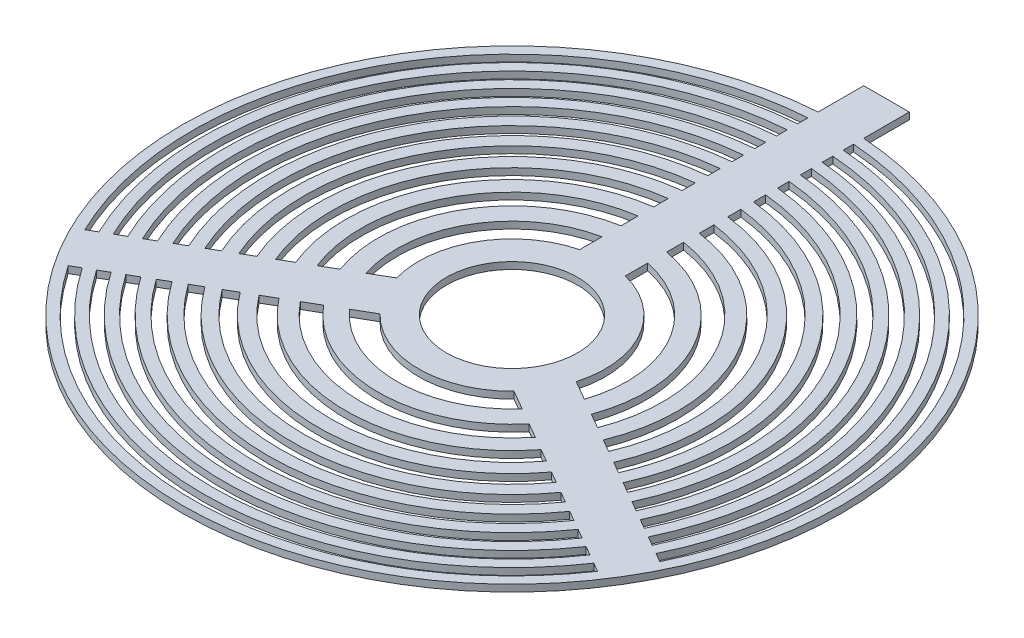
from build123d import *

# Parameters (mm, degrees)
SKETCH_4_R      = 28.77
EXTRUDE_1_DEPTH = 3


with BuildPart() as part:
    # 草图4 → 凸台-拉伸1 (new body)
    with BuildSketch(Plane(origin=(0, 0, 0), x_dir=(1, 0, 0), z_dir=(0, 1, 0))):
        with BuildLine():
            Line((-10, 144.374091859), (-10, 164.374091859))
            Line((-10, 164.374091859), (10, 164.374091859))
            Line((10, 164.374091859), (10, 144.374091859))
            ThreePointArc((10, 144.374091859), (0, -144.72), (-10, 144.374091859))
        make_face()
        with Locations(Location((0, 0, 0), (0, 0, 270))):
            Circle(SKETCH_4_R, mode=Mode.SUBTRACT)
        with BuildLine():
            Line((126.17697306, -61.301303978), (122.26090429, -59.04036062))
            ThreePointArc((122.26090429, -59.04036062), (117.580269072, 67.885), (10, 135.401229315))
            Line((10, 135.401229315), (10, 139.923116032))
            ThreePointArc((10, 139.923116032), (121.486043643, 70.14), (126.17697306, -61.301303978))
        make_face(mode=Mode.SUBTRACT)
        with BuildLine():
            Line((-10, 139.923116032), (-10, 135.401229315))
            ThreePointArc((-10, 135.401229315), (-117.580269072, 67.885), (-122.26090429, -59.04036062))
            Line((-122.26090429, -59.04036062), (-126.17697306, -61.301303978))
            ThreePointArc((-126.17697306, -61.301303978), (-121.486043643, 70.14), (-10, 139.923116032))
        make_face(mode=Mode.SUBTRACT)
        with BuildLine():
            Line((116.17697306, -78.621812054), (112.26090429, -76.360868695))
            ThreePointArc((112.26090429, -76.360868695), (0, -135.77), (-112.26090429, -76.360868695))
            Line((-112.26090429, -76.360868695), (-116.17697306, -78.621812054))
            ThreePointArc((-116.17697306, -78.621812054), (0, -140.28), (116.17697306, -78.621812054))
        make_face(mode=Mode.SUBTRACT)
        with BuildLine():
            Line((-110.151850554, -52.049195185), (-105.954197535, -49.625679085))
            ThreePointArc((-105.954197535, -49.625679085), (-101.324972243, 58.5), (-10, 116.571866246))
            Line((-10, 116.571866246), (-10, 121.418898447))
            ThreePointArc((-10, 121.418898447), (-105.507874943, 60.915), (-110.151850554, -52.049195185))
        make_face(mode=Mode.SUBTRACT)
        with BuildLine():
            Line((-118.292012075, -56.748919631), (-114.252811749, -54.416886235))
            ThreePointArc((-114.252811749, -54.416886235), (-109.595514849, 63.275), (-10, 126.154280546))
            Line((-10, 126.154280546), (-10, 130.818347337))
            ThreePointArc((-10, 130.818347337), (-113.622532977, 65.6), (-118.292012075, -56.748919631))
        make_face(mode=Mode.SUBTRACT)
        with BuildLine():
            Line((-108.292012075, -74.069427706), (-104.252811749, -71.737394311))
            ThreePointArc((-104.252811749, -71.737394311), (0, -126.55), (104.252811749, -71.737394311))
            Line((104.252811749, -71.737394311), (108.292012075, -74.069427706))
            ThreePointArc((108.292012075, -74.069427706), (0, -131.2), (-108.292012075, -74.069427706))
        make_face(mode=Mode.SUBTRACT)
        with BuildLine():
            Line((-100.151850554, -69.369703261), (-95.954197535, -66.946187161))
            ThreePointArc((-95.954197535, -66.946187161), (0, -117), (95.954197535, -66.946187161))
            Line((95.954197535, -66.946187161), (100.151850554, -69.369703261))
            ThreePointArc((100.151850554, -69.369703261), (0, -121.83), (-100.151850554, -69.369703261))
        make_face(mode=Mode.SUBTRACT)
        with BuildLine():
            Line((-101.67701278, -47.156245315), (-97.293939129, -44.625676563))
            ThreePointArc((-97.293939129, -44.625676563), (-92.699359221, 53.52), (-10, 106.571861202))
            Line((-10, 106.571861202), (-10, 111.632998706))
            ThreePointArc((-10, 111.632998706), (-97.064127256, 56.04), (-101.67701278, -47.156245315))
        make_face(mode=Mode.SUBTRACT)
        with BuildLine():
            Line((-92.787212622, -42.023716801), (-88.138936726, -39.340033461))
            ThreePointArc((-88.138936726, -39.340033461), (-83.588771973, 48.26), (-10, 96.000574998))
            Line((-10, 96.000574998), (-10, 101.367941678))
            ThreePointArc((-10, 101.367941678), (-88.213347629, 50.93), (-92.787212622, -42.023716801))
        make_face(mode=Mode.SUBTRACT)
        with BuildLine():
            Line((-83.331028335, -36.564186257), (-78.318973499, -33.670475049))
            ThreePointArc((-78.318973499, -33.670475049), (-73.828665673, 42.625), (-10, 84.661458173))
            Line((-10, 84.661458173), (-10, 90.44888059))
            ThreePointArc((-10, 90.44888059), (-78.808311744, 45.5), (-83.331028335, -36.564186257))
        make_face(mode=Mode.SUBTRACT)
        with BuildLine():
            Line((-73.075202534, -30.64298247), (-67.527706459, -27.440134118))
            ThreePointArc((-67.527706459, -27.440134118), (-63.124591682, 36.445), (-10, 72.200776312))
            Line((-10, 72.200776312), (-10, 78.606473016))
            ThreePointArc((-10, 78.606473016), (-68.623852996, 39.62), (-73.075202534, -30.64298247))
        make_face(mode=Mode.SUBTRACT)
        with BuildLine():
            Line((-61.58540006, -24.009341919), (-55.118955246, -20.275938265))
            ThreePointArc((-55.118955246, -20.275938265), (-50.861671964, 29.365), (-10, 57.872384606))
            Line((-10, 57.872384606), (-10, 65.339191914))
            ThreePointArc((-10, 65.339191914), (-57.24427919, 33.05), (-61.58540006, -24.009341919))
        make_face(mode=Mode.SUBTRACT)
        with BuildLine():
            Line((-47.885927762, -16.0999479), (-39.407930409, -11.205173846))
            ThreePointArc((-39.407930409, -11.205173846), (-35.481060793, 20.485), (-10, 39.730855767))
            Line((-10, 39.730855767), (-10, 49.520403876))
            ThreePointArc((-10, 49.520403876), (-43.751603399, 25.26), (-47.885927762, -16.0999479))
        make_face(mode=Mode.SUBTRACT)
        with BuildLine():
            Line((-37.885927762, -33.420455976), (-29.407930409, -28.525681921))
            ThreePointArc((-29.407930409, -28.525681921), (0, -40.97), (29.407930409, -28.525681921))
            Line((29.407930409, -28.525681921), (37.885927762, -33.420455976))
            ThreePointArc((37.885927762, -33.420455976), (0, -50.52), (-37.885927762, -33.420455976))
        make_face(mode=Mode.SUBTRACT)
        with BuildLine():
            Line((-51.58540006, -41.329849995), (-45.118955246, -37.596446341))
            ThreePointArc((-45.118955246, -37.596446341), (0, -58.73), (45.118955246, -37.596446341))
            Line((45.118955246, -37.596446341), (51.58540006, -41.329849995))
            ThreePointArc((51.58540006, -41.329849995), (0, -66.1), (-51.58540006, -41.329849995))
        make_face(mode=Mode.SUBTRACT)
        with BuildLine():
            Line((-63.075202534, -47.963490546), (-57.527706459, -44.760642194))
            ThreePointArc((-57.527706459, -44.760642194), (0, -72.89), (57.527706459, -44.760642194))
            Line((57.527706459, -44.760642194), (63.075202534, -47.963490546))
            ThreePointArc((63.075202534, -47.963490546), (0, -79.24), (-63.075202534, -47.963490546))
        make_face(mode=Mode.SUBTRACT)
        with BuildLine():
            Line((-82.787212622, -59.344224877), (-78.138936726, -56.660541537))
            ThreePointArc((-78.138936726, -56.660541537), (0, -96.52), (78.138936726, -56.660541537))
            Line((78.138936726, -56.660541537), (82.787212622, -59.344224877))
            ThreePointArc((82.787212622, -59.344224877), (0, -101.86), (-82.787212622, -59.344224877))
        make_face(mode=Mode.SUBTRACT)
        with BuildLine():
            Line((-73.331028335, -53.884694333), (-68.318973499, -50.990983124))
            ThreePointArc((-68.318973499, -50.990983124), (0, -85.25), (68.318973499, -50.990983124))
            Line((68.318973499, -50.990983124), (73.331028335, -53.884694333))
            ThreePointArc((73.331028335, -53.884694333), (0, -91), (-73.331028335, -53.884694333))
        make_face(mode=Mode.SUBTRACT)
        with BuildLine():
            Line((-91.67701278, -64.476753391), (-87.293939129, -61.946184639))
            ThreePointArc((-87.293939129, -61.946184639), (0, -107.04), (87.293939129, -61.946184639))
            Line((87.293939129, -61.946184639), (91.67701278, -64.476753391))
            ThreePointArc((91.67701278, -64.476753391), (0, -112.08), (-91.67701278, -64.476753391))
        make_face(mode=Mode.SUBTRACT)
        with BuildLine():
            Line((10, 49.520403876), (10, 39.730855767))
            ThreePointArc((10, 39.730855767), (35.481060793, 20.485), (39.407930409, -11.205173846))
            Line((39.407930409, -11.205173846), (47.885927762, -16.0999479))
            ThreePointArc((47.885927762, -16.0999479), (43.751603399, 25.26), (10, 49.520403876))
        make_face(mode=Mode.SUBTRACT)
        with BuildLine():
            Line((10, 65.339191914), (10, 57.872384606))
            ThreePointArc((10, 57.872384606), (50.861671964, 29.365), (55.118955246, -20.275938265))
            Line((55.118955246, -20.275938265), (61.58540006, -24.009341919))
            ThreePointArc((61.58540006, -24.009341919), (57.24427919, 33.05), (10, 65.339191914))
        make_face(mode=Mode.SUBTRACT)
        with BuildLine():
            Line((10, 78.606473016), (10, 72.200776312))
            ThreePointArc((10, 72.200776312), (63.124591682, 36.445), (67.527706459, -27.440134118))
            Line((67.527706459, -27.440134118), (73.075202534, -30.64298247))
            ThreePointArc((73.075202534, -30.64298247), (68.623852996, 39.62), (10, 78.606473016))
        make_face(mode=Mode.SUBTRACT)
        with BuildLine():
            Line((10, 90.44888059), (10, 84.661458173))
            ThreePointArc((10, 84.661458173), (73.828665673, 42.625), (78.318973499, -33.670475049))
            Line((78.318973499, -33.670475049), (83.331028335, -36.564186257))
            ThreePointArc((83.331028335, -36.564186257), (78.808311744, 45.5), (10, 90.44888059))
        make_face(mode=Mode.SUBTRACT)
        with BuildLine():
            Line((10, 101.367941678), (10, 96.000574998))
            ThreePointArc((10, 96.000574998), (83.588771973, 48.26), (88.138936726, -39.340033461))
            Line((88.138936726, -39.340033461), (92.787212622, -42.023716801))
            ThreePointArc((92.787212622, -42.023716801), (88.213347629, 50.93), (10, 101.367941678))
        make_face(mode=Mode.SUBTRACT)
        with BuildLine():
            Line((10, 111.632998706), (10, 106.571861202))
            ThreePointArc((10, 106.571861202), (92.699359221, 53.52), (97.293939129, -44.625676563))
            Line((97.293939129, -44.625676563), (101.67701278, -47.156245315))
            ThreePointArc((101.67701278, -47.156245315), (97.064127256, 56.04), (10, 111.632998706))
        make_face(mode=Mode.SUBTRACT)
        with BuildLine():
            Line((10, 121.418898447), (10, 116.571866246))
            ThreePointArc((10, 116.571866246), (101.324972243, 58.5), (105.954197535, -49.625679085))
            Line((105.954197535, -49.625679085), (110.151850554, -52.049195185))
            ThreePointArc((110.151850554, -52.049195185), (105.507874943, 60.915), (10, 121.418898447))
        make_face(mode=Mode.SUBTRACT)
        with BuildLine():
            Line((10, 130.818347337), (10, 126.154280546))
            ThreePointArc((10, 126.154280546), (109.595514849, 63.275), (114.252811749, -54.416886235))
            Line((114.252811749, -54.416886235), (118.292012075, -56.748919631))
            ThreePointArc((118.292012075, -56.748919631), (113.622532977, 65.6), (10, 130.818347337))
        make_face(mode=Mode.SUBTRACT)
    extrude(amount=EXTRUDE_1_DEPTH)


solid = part.part
